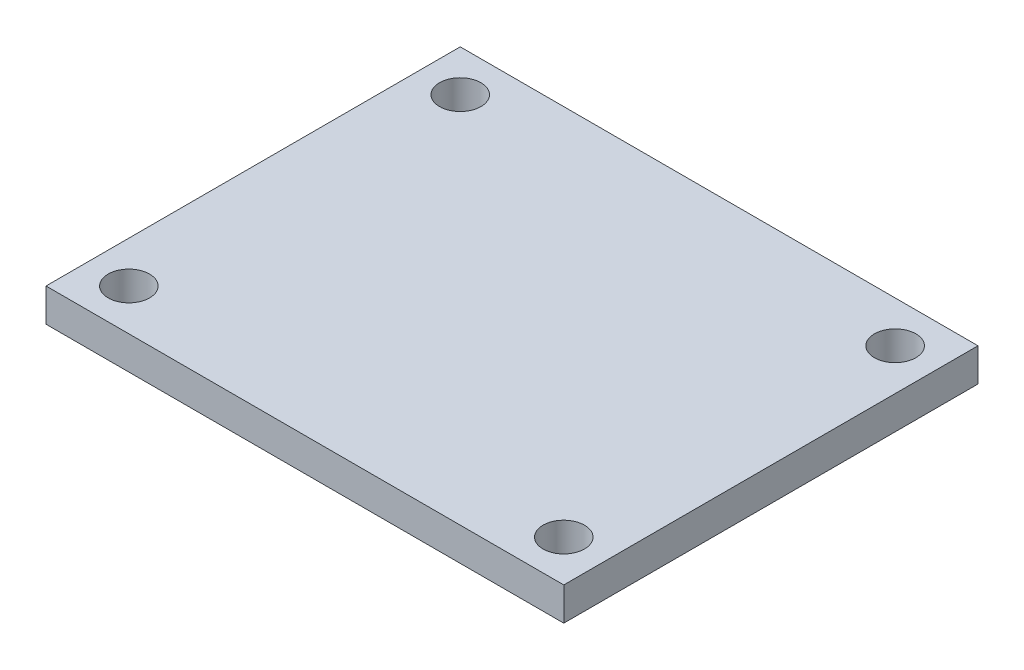
from build123d import *

# Parameters (mm, degrees)
ESQUISSE1_W      = 25
ESQUISSE1_H      = 20
ESQUISSE1_R      = 1
EXTRUSION1_DEPTH = 1.6


with BuildPart() as part:
    # Esquisse1 → Extrusion1 (new body)
    with BuildSketch(Plane(origin=(0, 0, 0), x_dir=(1, 0, 0), z_dir=(0, 1, 0))):
        Rectangle(ESQUISSE1_W, ESQUISSE1_H)
        with Locations(Location((-10.5, 8, 0), (0, 0, 270))):
            Circle(ESQUISSE1_R, mode=Mode.SUBTRACT)
        with Locations(Location((10.5, 8, 0), (0, 0, 90))):
            Circle(ESQUISSE1_R, mode=Mode.SUBTRACT)
        with Locations(Location((10.5, -8, 0), (0, 0, 270))):
            Circle(ESQUISSE1_R, mode=Mode.SUBTRACT)
        with Locations(Location((-10.5, -8, 0), (0, 0, 90))):
            Circle(ESQUISSE1_R, mode=Mode.SUBTRACT)
    extrude(amount=EXTRUSION1_DEPTH)


solid = part.part
